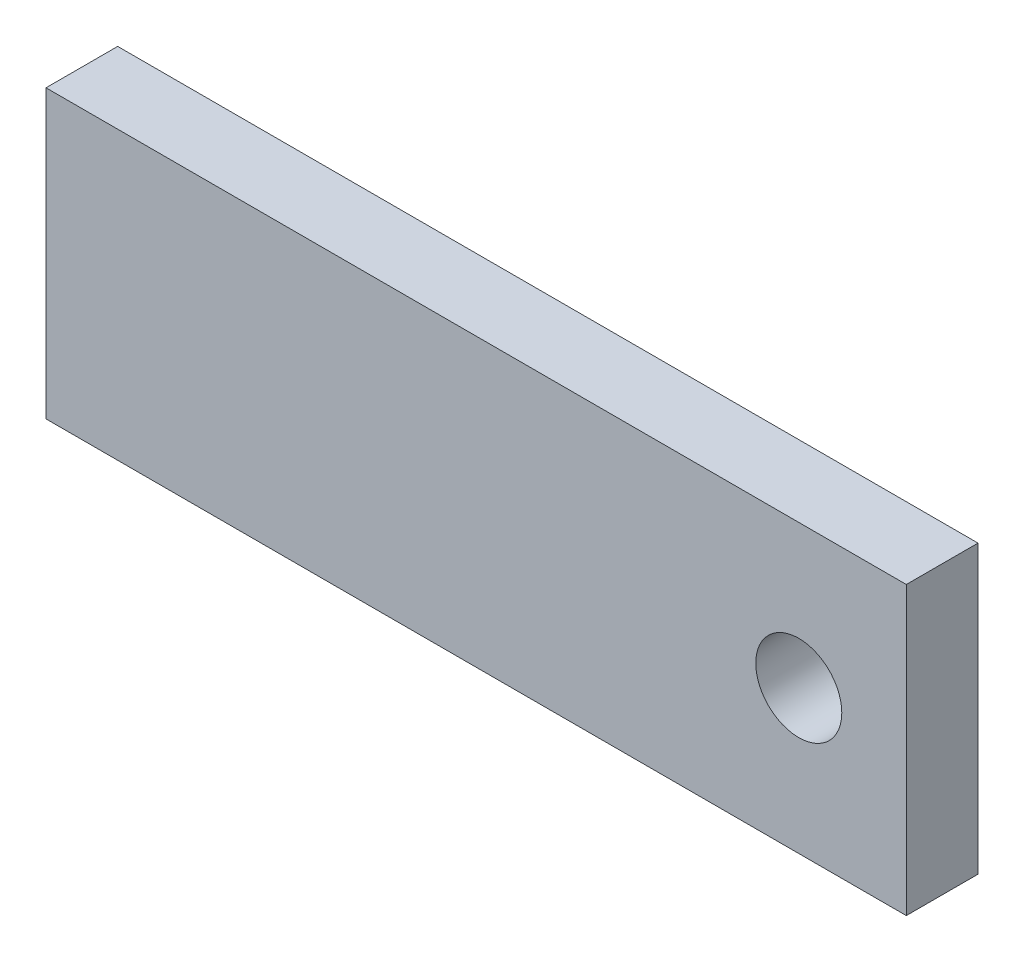
from build123d import *

# Parameters (mm, degrees)
SKETCH_2_W          = 120
SKETCH_2_H          = 40
EXTRUDE_1_DEPTH     = 10
SKETCH_3_R          = 6
CUT_EXTRUDE_1_DEPTH = 123.065556157


with BuildPart() as part:
    # 草图2 → 凸台-拉伸1 (new body)
    with BuildSketch(Plane.XY):
        with Locations((60, 0)):
            Rectangle(SKETCH_2_W, SKETCH_2_H)
    extrude(amount=EXTRUDE_1_DEPTH)

    # 草图3 → 切除-拉伸1 (cut, through all)
    with BuildSketch(Plane.XY.offset(10)):
        with Locations((105, 0)):
            Circle(SKETCH_3_R)
    extrude(amount=-CUT_EXTRUDE_1_DEPTH, mode=Mode.SUBTRACT)


solid = part.part
